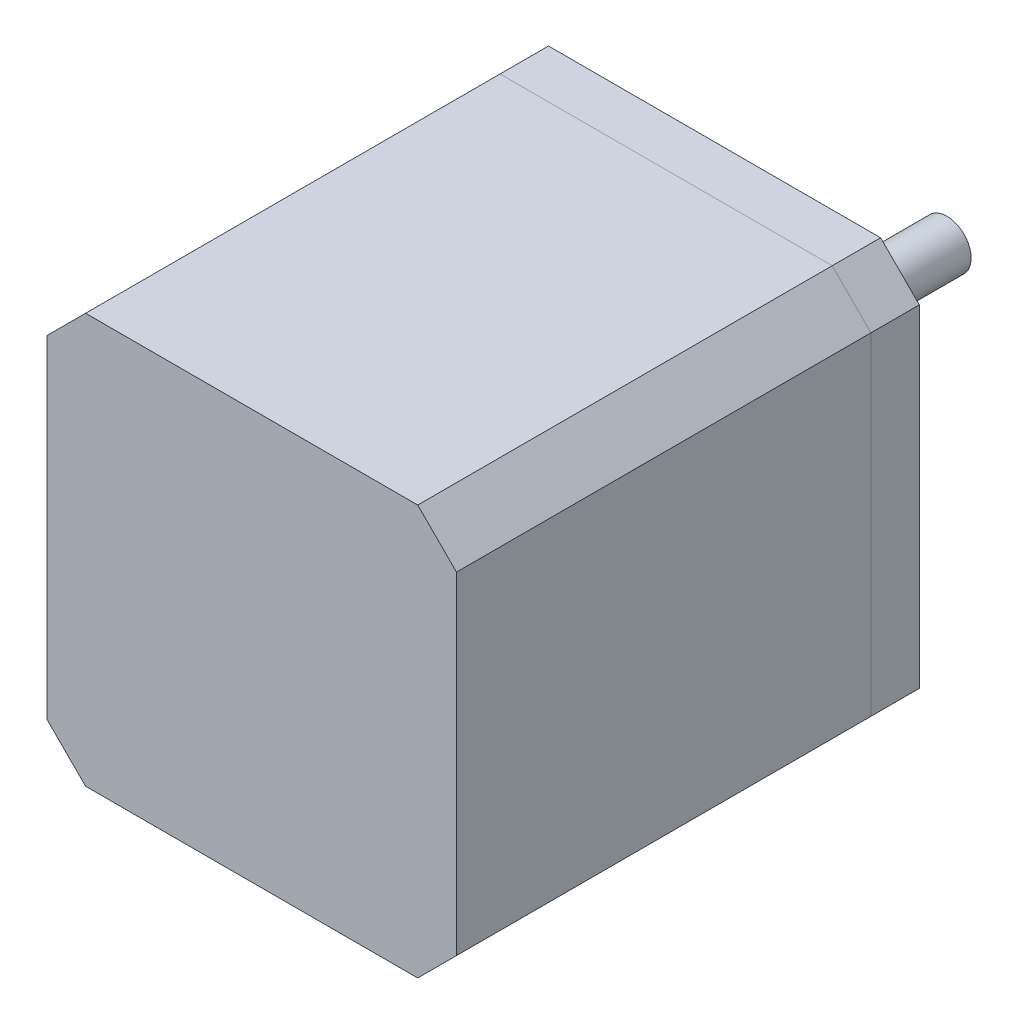
from build123d import *

# Parameters (mm, degrees)
SKETCH_1_W      = 42.3
SKETCH_1_H      = 42.3
FRONT_DEPTH     = 5
CHAMFER_1_SIZE  = 4
SKETCH_2_R      = 11
EXTRUDE_2_DEPTH = 2
SKETCH_3_R      = 2.5
SHAFT_DEPTH     = 22
SLOT_START      = -15
SLOT_DEPTH      = 15
SKETCH_5_R      = 1.25
HOLES_DEPTH     = 4
BODY_DEPTH      = 42.8


with BuildPart() as part:
    # Эскиз1 → front (new body)
    with BuildSketch(Plane(origin=(0, 0, 0), x_dir=(1, 0, 0), z_dir=(0, 0, -1))):
        with Locations((21.15, 21.15)):
            Rectangle(SKETCH_1_W, SKETCH_1_H)
    extrude(amount=FRONT_DEPTH)

    # Фаска1
    chamfer_1_edges = [part.edges().sort_by_distance(p)[0] for p in [
        (0, -42.3, -2.5),
        (42.3, -42.3, -2.5),
        (42.3, 0, -2.5),
        (0, 0, -2.5),
    ]]
    chamfer(chamfer_1_edges, length=CHAMFER_1_SIZE)

    # Эскиз2 → Вытянуть2 (add)
    with BuildSketch(Plane(origin=(0, 0, -5), x_dir=(1, 0, 0), z_dir=(0, 0, -1))):
        with Locations((21.15, 21.15)):
            Circle(SKETCH_2_R)
    extrude(amount=EXTRUDE_2_DEPTH)

    # Эскиз3 → shaft (add)
    with BuildSketch(Plane(origin=(0, 0, -7), x_dir=(1, 0, 0), z_dir=(0, 0, -1))):
        with Locations(Location((21.15, 21.15, 0), (0, 0, 270))):
            Circle(SKETCH_3_R)
    extrude(amount=SHAFT_DEPTH)

    # Эскиз4 → slot (cut)
    with BuildSketch(Plane(origin=(0, 0, -29), x_dir=(1, 0, 0), z_dir=(0, 0, -1)).offset(SLOT_START)):
        with BuildLine():
            Line((19.15, 22.65), (19.15, 19.65))
            ThreePointArc((19.15, 19.65), (18.65, 21.15), (19.15, 22.65))
        make_face()
    extrude(amount=SLOT_DEPTH, mode=Mode.SUBTRACT)

    # Эскиз5 → holes (cut)
    with BuildSketch(Plane(origin=(0, 0, -5), x_dir=(-1, 0, 0), z_dir=(0, 0, -1))):
        with Locations((-36.8, -5.5)):
            Circle(SKETCH_5_R)
        with Locations(Location((-5.5, -5.5, 0), (0, 0, 180))):
            Circle(SKETCH_5_R)
        with Locations((-5.5, -36.8)):
            Circle(SKETCH_5_R)
        with Locations(Location((-36.8, -36.8, 0), (0, 0, 180))):
            Circle(SKETCH_5_R)
    extrude(amount=-HOLES_DEPTH, mode=Mode.SUBTRACT)


with BuildPart() as body_2:
    # Эскиз6 → body (new body)
    with BuildSketch(Plane.XY):
        Polygon((0, -4), (4, 0), (38.3, 0), (42.3, -4), (42.3, -38.3), (38.3, -42.3), (4, -42.3), (0, -38.3), align=None)
    extrude(amount=BODY_DEPTH)


solid = Compound([part.part, body_2.part])
